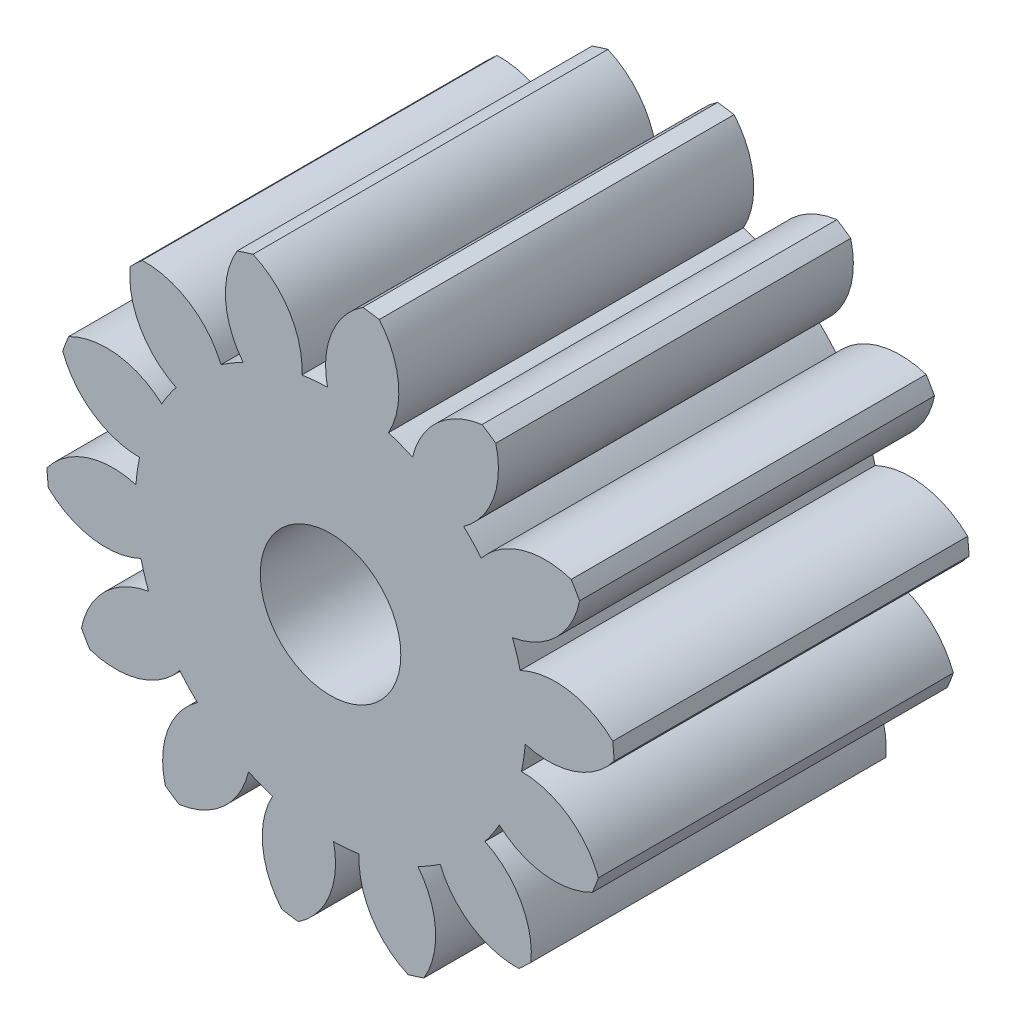
from build123d import *

# Parameters (mm, degrees)
CROQUIS1_R              = 4
CROQUIS1_R_2            = 0.99
SALIENTE_EXTRUIR1_DEPTH = 5
CORTAR_EXTRUIR1_START   = -5
CORTAR_EXTRUIR1_DEPTH   = 5
MATRIZC1_COUNT          = 14


with BuildPart() as part:
    # Croquis1 → Saliente-Extruir1 (new body)
    with BuildSketch(Plane.XY):
        Circle(CROQUIS1_R)
        Circle(CROQUIS1_R_2, mode=Mode.SUBTRACT)
    extrude(amount=SALIENTE_EXTRUIR1_DEPTH)

    # Croquis2 → Cortar-Extruir1 (cut)
    with BuildSketch(Plane.XY.offset(5).offset(CORTAR_EXTRUIR1_START)):
        with BuildLine():
            ThreePointArc((0.454178812, 3.974131554), (-0.325031004, 3.986772485), (-1.091903299, 3.848083573))
            ThreePointArc((-1.091903299, 3.848083573), (-0.571993768, 3.391411982), (-0.403583734, 2.720224287))
            ThreePointArc((-0.403583734, 2.720224287), (-0.223458815, 2.740906083), (-0.042362565, 2.749673692))
            ThreePointArc((-0.042362565, 2.749673692), (0.01510581, 3.439276656), (0.454178812, 3.974131554))
        make_face()
    cortar_extruir1 = extrude(amount=CORTAR_EXTRUIR1_DEPTH, mode=Mode.SUBTRACT)

    # MatrizC1: Cortar-Extruir1 ×14 about axis
    matrizc1_axis = Axis((0, 0, 0), (0, 0, 1))
    for i in range(1, MATRIZC1_COUNT):
        add(cortar_extruir1.rotate(matrizc1_axis, i * 360 / MATRIZC1_COUNT), mode=Mode.SUBTRACT)


solid = part.part
